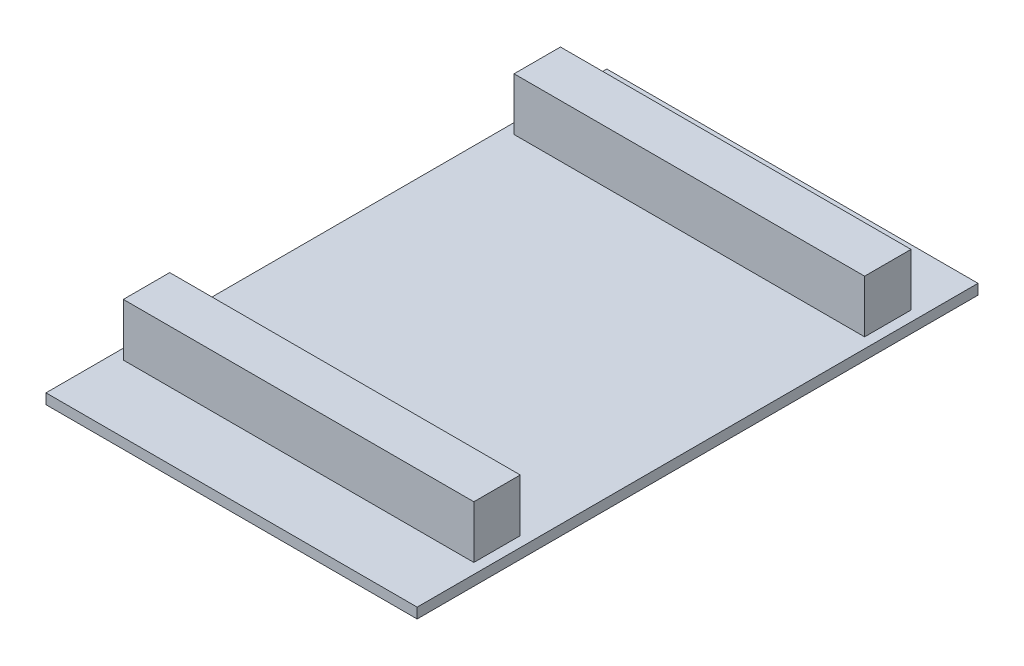
from build123d import *

# Parameters (mm, degrees)
ESBO_O1_W                = 36
ESBO_O1_H                = 54.4
RESSALTO_EXTRUS_O1_DEPTH = 1
ESBO_O2_W                = 34
ESBO_O2_H                = 4.5
RESSALTO_EXTRUS_O2_DEPTH = 5.1


with BuildPart() as part:
    # Esboço1 → Ressalto-extrusão1 (new body)
    with BuildSketch(Plane(origin=(0, 0, 0), x_dir=(1, 0, 0), z_dir=(0, 1, 0))):
        Rectangle(ESBO_O1_W, ESBO_O1_H)
    extrude(amount=RESSALTO_EXTRUS_O1_DEPTH)

    # Esboço2 → Ressalto-extrusão2 (add)
    with BuildSketch(Plane(origin=(0, 1, 0), x_dir=(1, 0, 0), z_dir=(0, 1, 0))):
        with Locations((0, -18.45)):
            Rectangle(ESBO_O2_W, ESBO_O2_H)
        with Locations((0, 19.45)):
            Rectangle(ESBO_O2_W, ESBO_O2_H)
    extrude(amount=RESSALTO_EXTRUS_O2_DEPTH)


solid = part.part
